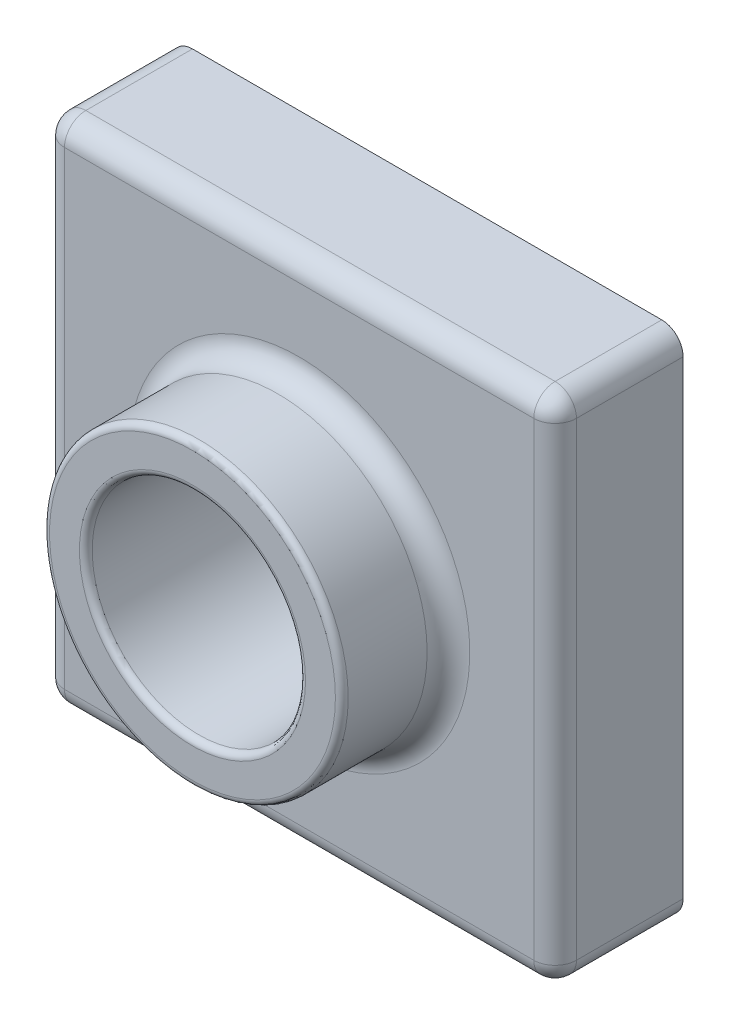
from build123d import *

# Parameters (mm, degrees)
SKETCH2_W           = 120
SKETCH2_H           = 120
BOSS_EXTRUDE1_DEPTH = 30
SKETCH4_R           = 35
BOSS_EXTRUDE2_DEPTH = 25
SKETCH6_R           = 25
CUT_EXTRUDE1_DEPTH  = 179.395627749
FILLET1_R           = 5
FILLET2_R           = 1.5
SHELL1_T            = -2


with BuildPart() as part:
    # Sketch2 → Boss-Extrude1 (new body)
    with BuildSketch(Plane.XY):
        with Locations((60, 60)):
            Rectangle(SKETCH2_W, SKETCH2_H)
    extrude(amount=BOSS_EXTRUDE1_DEPTH)

    # Sketch4 → Boss-Extrude2 (add)
    with BuildSketch(Plane.XY.offset(30)):
        with Locations(Location((60, 60, 0), (0, 0, 180))):
            Circle(SKETCH4_R)
    extrude(amount=BOSS_EXTRUDE2_DEPTH)

    # Sketch6 → Cut-Extrude1 (cut, through all)
    with BuildSketch(Plane.XY.offset(55)):
        with Locations((60, 60)):
            Circle(SKETCH6_R)
    extrude(amount=-CUT_EXTRUDE1_DEPTH, mode=Mode.SUBTRACT)

    # Fillet1
    fillet1_edges = [part.edges().sort_by_distance(p)[0] for p in [
        (120, 60, 30),
        (60, 120, 30),
        (95, 60, 30),
        (0, 60, 30),
        (60, 0, 30),
        (0, 120, 15),
        (120, 120, 15),
        (120, 0, 15),
        (0, 0, 15),
    ]]
    fillet(fillet1_edges, radius=FILLET1_R)

    # Fillet2
    fillet2_edges = [part.edges().sort_by_distance(p)[0] for p in [
        (95, 60, 55),
        (35, 60, 55),
    ]]
    fillet(fillet2_edges, radius=FILLET2_R)

    # Shell1
    shell1_openings = [part.faces().sort_by_distance(p)[0] for p in [
        (60, 1.697056275, 0),
    ]]
    offset(amount=SHELL1_T, openings=shell1_openings, kind=Kind.INTERSECTION)


solid = part.part
